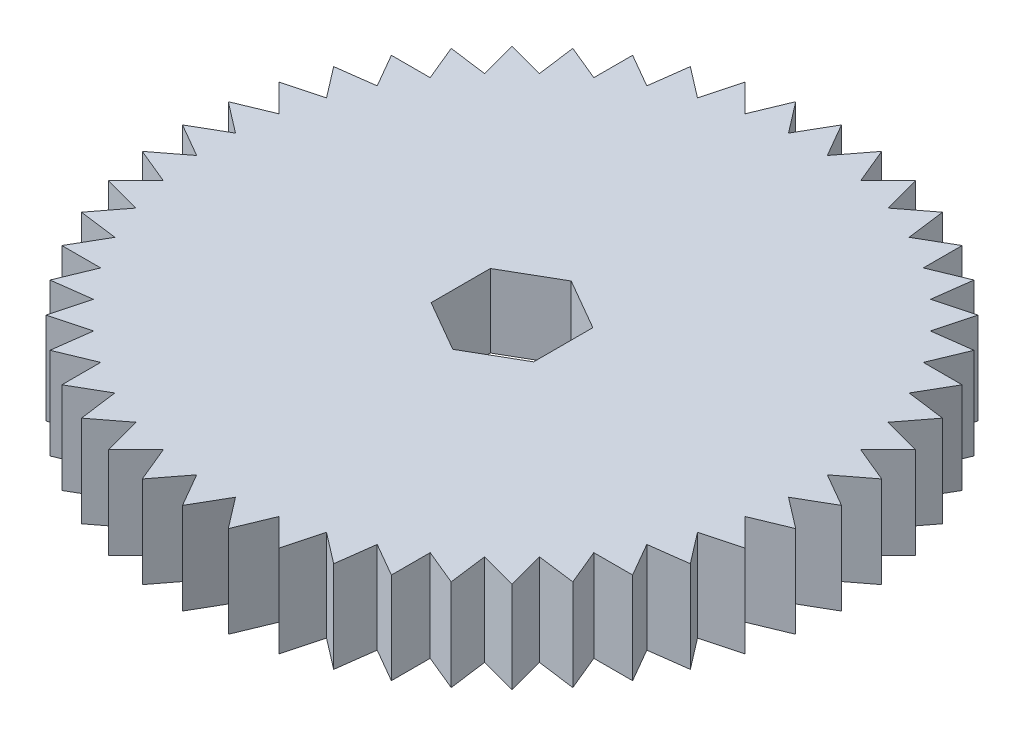
from build123d import *

# Parameters (mm, degrees)
SKETCH1_R           = 19.05
BOSS_EXTRUDE1_DEPTH = 5.08
BOSS_EXTRUDE3_DEPTH = 6.35
CIRPATTERN1_COUNT   = 48
CUT_EXTRUDE1_DEPTH  = 33.725610766


with BuildPart() as part:
    # Sketch1 → Boss-Extrude1 (new body)
    with BuildSketch(Plane(origin=(0, 0, 0), x_dir=(1, 0, 0), z_dir=(0, 1, 0))):
        Circle(SKETCH1_R)
    extrude(amount=BOSS_EXTRUDE1_DEPTH)

    # Sketch3 → Boss-Extrude3 (add)
    with BuildSketch(Plane(origin=(0, 5.08, 0), x_dir=(1, 0, 0), z_dir=(0, 1, 0))):
        Polygon((0, 22.86), (2.278670365, 18.913227154), (-2.278670365, 18.913227154), align=None)
    boss_extrude3 = extrude(amount=-BOSS_EXTRUDE3_DEPTH)

    # CirPattern1: Boss-Extrude3 ×48 about axis
    cirpattern1_axis = Axis((0, -0.127, 0), (0, 1, 0))
    for i in range(1, CIRPATTERN1_COUNT):
        add(boss_extrude3.rotate(cirpattern1_axis, i * 360 / CIRPATTERN1_COUNT))

    # Sketch6 → Cut-Extrude1 (cut, through all)
    with BuildSketch(Plane.XZ):
        Polygon((0, -4.106115114), (3.556, -2.053057557), (3.556, 2.053057557), (0, 4.106115114), (-3.556, 2.053057557), (-3.556, -2.053057557), align=None)
    extrude(amount=-CUT_EXTRUDE1_DEPTH, mode=Mode.SUBTRACT)


solid = part.part
